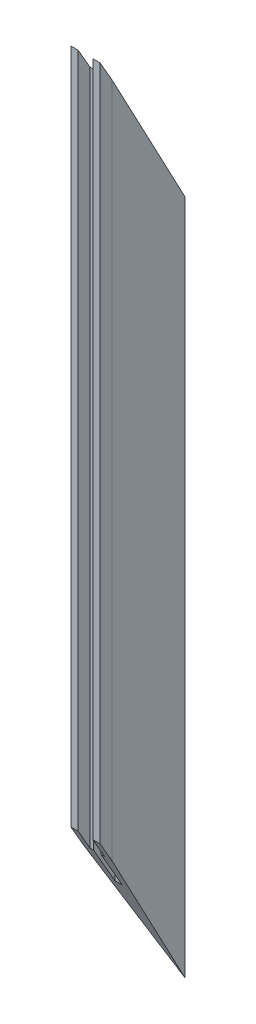
from build123d import *

# Parameters (mm, degrees)
BOSS_EXTRUDE1_DEPTH = 369.316
CUT_EXTRUDE1_DEPTH  = 17.526
CUT_EXTRUDE2_DEPTH  = 17.526


with BuildPart() as part:
    # Sketch1 → Boss-Extrude1 (new body)
    with BuildSketch(Plane(origin=(0, 0, 0), x_dir=(1, 0, 0), z_dir=(0, 1, 0))):
        Polygon((0, 38.1), (-6.35, 0), (-6.35, -5.08), (-3.175, -5.08), (-3.175, 0), (-1.5875, 0), (-1.5875, 9.262228966), (1.5875, 9.262228966), (1.5875, 0), (3.175, 0), (3.175, -5.08), (6.35, -5.08), (6.35, 0), align=None)
    extrude(amount=BOSS_EXTRUDE1_DEPTH)

    # Sketch2 → Cut-Extrude1 (cut)
    with BuildSketch(Plane.ZY.offset(6.35)):
        Polygon((5.08, 369.316), (-38.1, 294.223678497), (-38.1, 369.316), align=None)
    extrude(amount=-CUT_EXTRUDE1_DEPTH, mode=Mode.SUBTRACT)

    # Sketch3 → Cut-Extrude2 (cut)
    with BuildSketch(Plane.ZY.offset(6.35)):
        Polygon((5.08, 76.2), (-38.1, 1.107678497), (-38.1, 0), (5.08, 0), align=None)
    extrude(amount=-CUT_EXTRUDE2_DEPTH, mode=Mode.SUBTRACT)


solid = part.part
